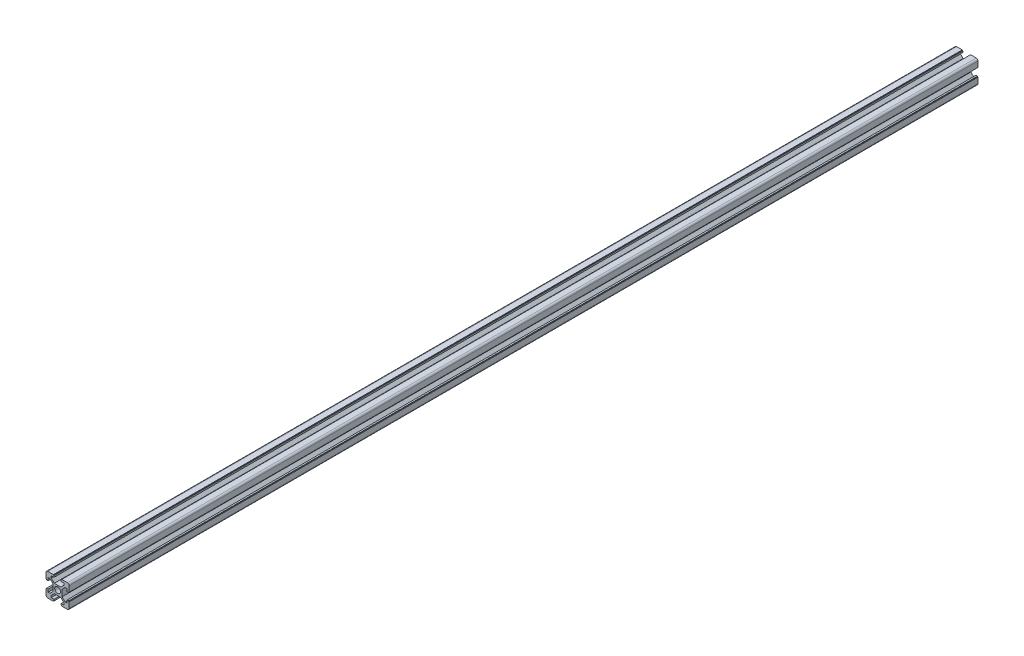
from build123d import *

# Parameters (mm, degrees)
SKETCH1_R           = 2.5
BOSS_EXTRUDE1_DEPTH = 786


with BuildPart() as part:
    # Sketch1 → Boss-Extrude1 (new body)
    with BuildSketch(Plane.XY):
        with BuildLine():
            Line((2.839339828, 3.9), (5.5, 6.560660172))
            Line((5.5, 6.560660172), (5.5, 8.2))
            Line((5.5, 8.2), (3.1, 8.2))
            Line((3.1, 8.2), (3.1, 9.5))
            Line((3.1, 9.5), (3.6, 9.5))
            Line((3.6, 9.5), (3.6, 10))
            Line((3.6, 10), (8.5, 10))
            ThreePointArc((8.5, 10), (9.560660172, 9.560660172), (10, 8.5))
            Line((10, 8.5), (10, 3.6))
            Line((10, 3.6), (9.5, 3.6))
            Line((9.5, 3.6), (9.5, 3.1))
            Line((9.5, 3.1), (8.2, 3.1))
            Line((8.2, 3.1), (8.2, 5.5))
            Line((8.2, 5.5), (6.560660172, 5.5))
            Line((6.560660172, 5.5), (3.9, 2.839339828))
            Line((3.9, 2.839339828), (3.9, -2.839339828))
            Line((3.9, -2.839339828), (6.560660172, -5.5))
            Line((6.560660172, -5.5), (8.2, -5.5))
            Line((8.2, -5.5), (8.2, -3.1))
            Line((8.2, -3.1), (9.5, -3.1))
            Line((9.5, -3.1), (9.5, -3.6))
            Line((9.5, -3.6), (10, -3.6))
            Line((10, -3.6), (10, -8.5))
            ThreePointArc((10, -8.5), (9.560660172, -9.560660172), (8.5, -10))
            Line((8.5, -10), (3.6, -10))
            Line((3.6, -10), (3.6, -9.5))
            Line((3.6, -9.5), (3.1, -9.5))
            Line((3.1, -9.5), (3.1, -8.2))
            Line((3.1, -8.2), (5.5, -8.2))
            Line((5.5, -8.2), (5.5, -6.560660172))
            Line((5.5, -6.560660172), (2.839339828, -3.9))
            Line((2.839339828, -3.9), (-2.839339828, -3.9))
            Line((-2.839339828, -3.9), (-5.5, -6.560660172))
            Line((-5.5, -6.560660172), (-5.5, -8.2))
            Line((-5.5, -8.2), (-3.1, -8.2))
            Line((-3.1, -8.2), (-3.1, -9.5))
            Line((-3.1, -9.5), (-3.6, -9.5))
            Line((-3.6, -9.5), (-3.6, -10))
            Line((-3.6, -10), (-8.5, -10))
            ThreePointArc((-8.5, -10), (-9.560660172, -9.560660172), (-10, -8.5))
            Line((-10, -8.5), (-10, -3.6))
            Line((-10, -3.6), (-9.5, -3.6))
            Line((-9.5, -3.6), (-9.5, -3.1))
            Line((-9.5, -3.1), (-8.2, -3.1))
            Line((-8.2, -3.1), (-8.2, -5.5))
            Line((-8.2, -5.5), (-6.560660172, -5.5))
            Line((-6.560660172, -5.5), (-3.9, -2.839339828))
            Line((-3.9, -2.839339828), (-3.9, 2.839339828))
            Line((-3.9, 2.839339828), (-6.560660172, 5.5))
            Line((-6.560660172, 5.5), (-8.2, 5.5))
            Line((-8.2, 5.5), (-8.2, 3.1))
            Line((-8.2, 3.1), (-9.5, 3.1))
            Line((-9.5, 3.1), (-9.5, 3.6))
            Line((-9.5, 3.6), (-10, 3.6))
            Line((-10, 3.6), (-10, 8.5))
            ThreePointArc((-10, 8.5), (-9.560660172, 9.560660172), (-8.5, 10))
            Line((-8.5, 10), (-3.6, 10))
            Line((-3.6, 10), (-3.6, 9.5))
            Line((-3.6, 9.5), (-3.1, 9.5))
            Line((-3.1, 9.5), (-3.1, 8.2))
            Line((-3.1, 8.2), (-5.5, 8.2))
            Line((-5.5, 8.2), (-5.5, 6.560660172))
            Line((-5.5, 6.560660172), (-2.839339828, 3.9))
            Line((-2.839339828, 3.9), (2.839339828, 3.9))
        make_face()
        with Locations((0, 0.235847297)):
            Circle(SKETCH1_R, mode=Mode.SUBTRACT)
    extrude(amount=BOSS_EXTRUDE1_DEPTH)


solid = part.part
